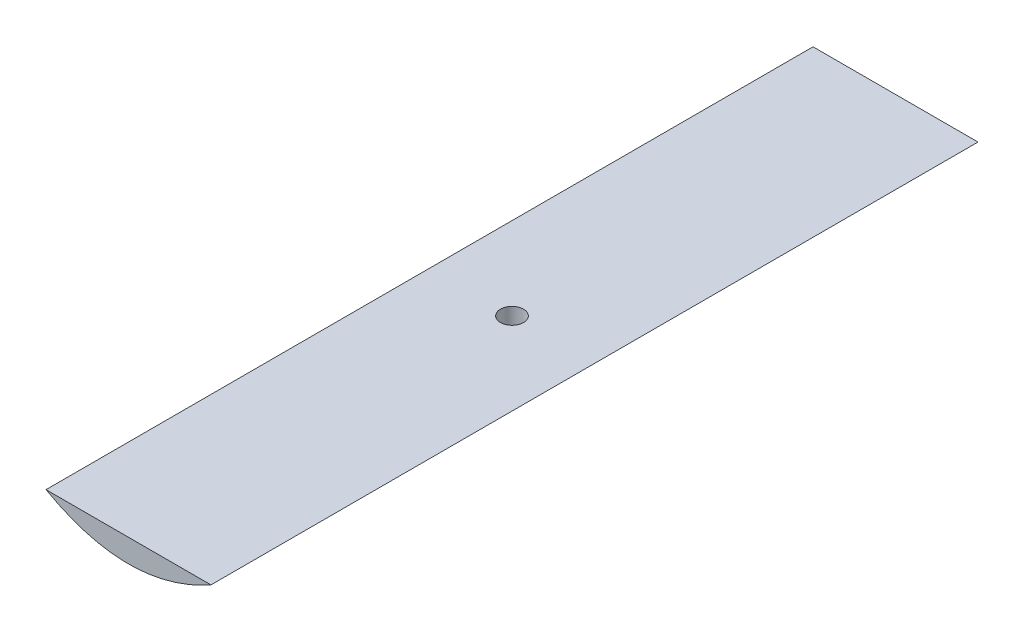
from build123d import *

# Parameters (mm, degrees)
BOSS_EXTRUDE2_DEPTH = 331.382
SKETCH3_R           = 5
CUT_EXTRUDE2_DEPTH  = 377.924435453
SKETCH5_W           = 260
SKETCH5_H           = 120
CUT_EXTRUDE4_DEPTH  = 377.924435453


with BuildPart() as part:
    # Sketch2 → Boss-Extrude2 (new body)
    with BuildSketch(Plane.XY):
        with BuildLine():
            Line((-127, 127), (127, 127))
            add(Edge.make_bspline(
                [(-127, 127), (0, -127), (127, 127)],
                knots=[0.056028396, 0.056028396, 0.056028396, 0.943971604, 0.943971604, 0.943971604], degree=2))
        make_face()
    extrude(amount=BOSS_EXTRUDE2_DEPTH)

    # Sketch3 → Cut-Extrude2 (cut, through all)
    with BuildSketch(Plane(origin=(0, 127, 0), x_dir=(1, 0, 0), z_dir=(0, 1, 0))):
        with Locations(Location((0, -165.691, 0), (0, 0, 270))):
            Circle(SKETCH3_R)
    extrude(amount=-CUT_EXTRUDE2_DEPTH, mode=Mode.SUBTRACT)

    # Sketch5 → Cut-Extrude4 (cut, through all)
    with BuildSketch(Plane.XY.offset(331.382)):
        with Locations((0, 70)):
            Rectangle(SKETCH5_W, SKETCH5_H)
    extrude(amount=-CUT_EXTRUDE4_DEPTH, mode=Mode.SUBTRACT)


solid = part.part
